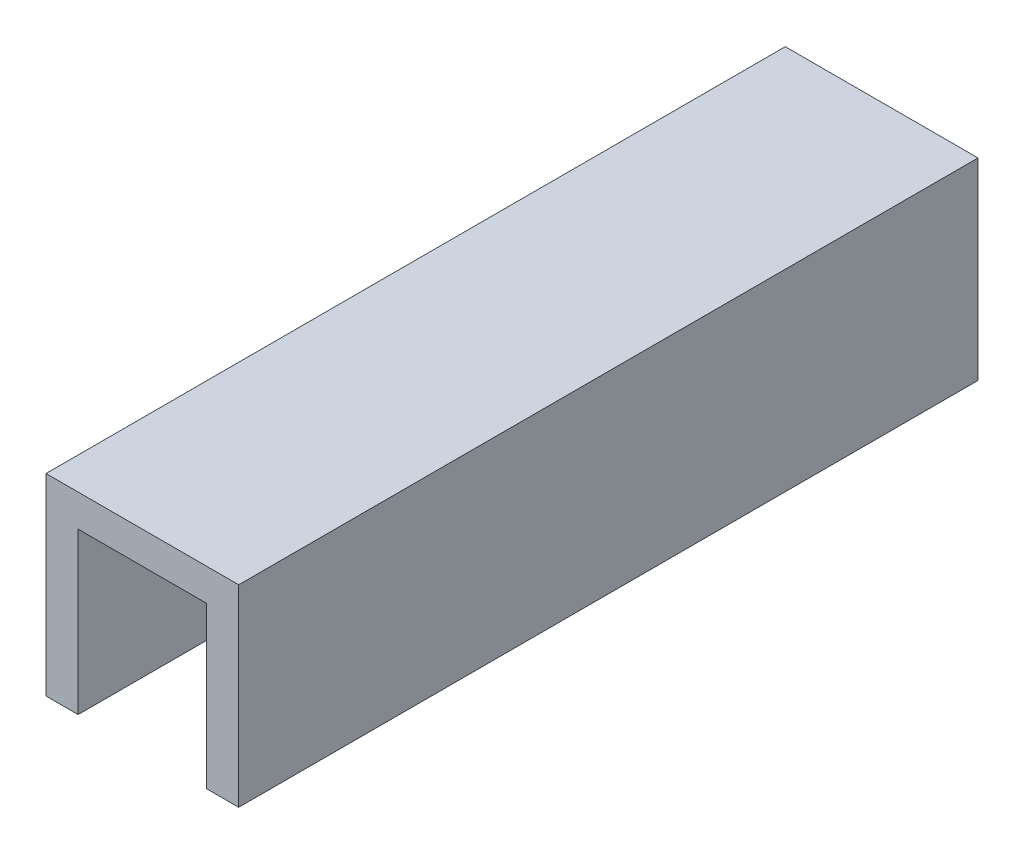
from build123d import *


with BuildPart() as part:
    # Sweep3: sweep along a path in Sketch3
    with BuildLine(Plane(origin=(0, 0, 0), x_dir=(0, 0, -1), z_dir=(1, 0, 0))) as sweep3_path:
        Line((0, 0), (-36.5379, 0))
    # Sketch2 → Sweep3 (sweep)
    with BuildSketch(Plane.XY):
        Polygon((0, 0), (6.35, 0), (6.35, -7.9375), (7.9375, -7.9375), (7.9375, 1.5875), (-1.5875, 1.5875), (-1.5875, -7.9375), (0, -7.9375), align=None)
    sweep(path=sweep3_path.line)


solid = part.part
